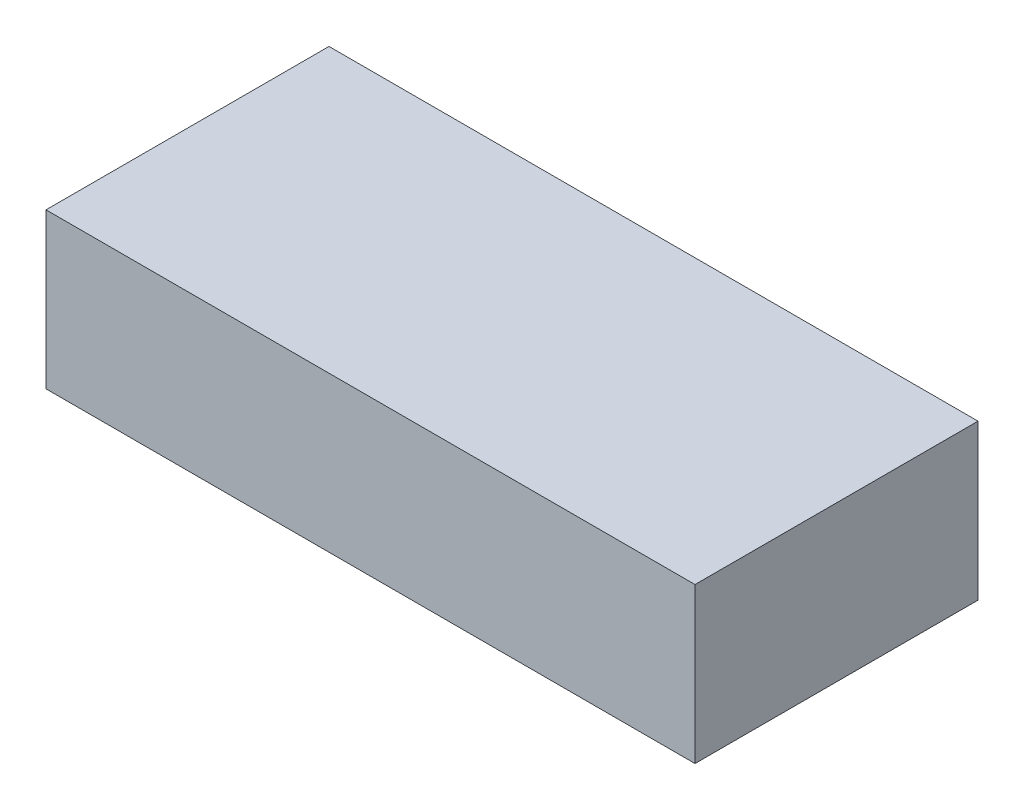
from build123d import *

# Parameters (mm, degrees)
SKETCH1_W           = 97.282
SKETCH1_H           = 42.418
BOSS_EXTRUDE1_DEPTH = 23.241


with BuildPart() as part:
    # Sketch1 → Boss-Extrude1 (new body)
    with BuildSketch(Plane(origin=(0, 0, 0), x_dir=(1, 0, 0), z_dir=(0, 1, 0))):
        Rectangle(SKETCH1_W, SKETCH1_H)
    extrude(amount=BOSS_EXTRUDE1_DEPTH)


solid = part.part
